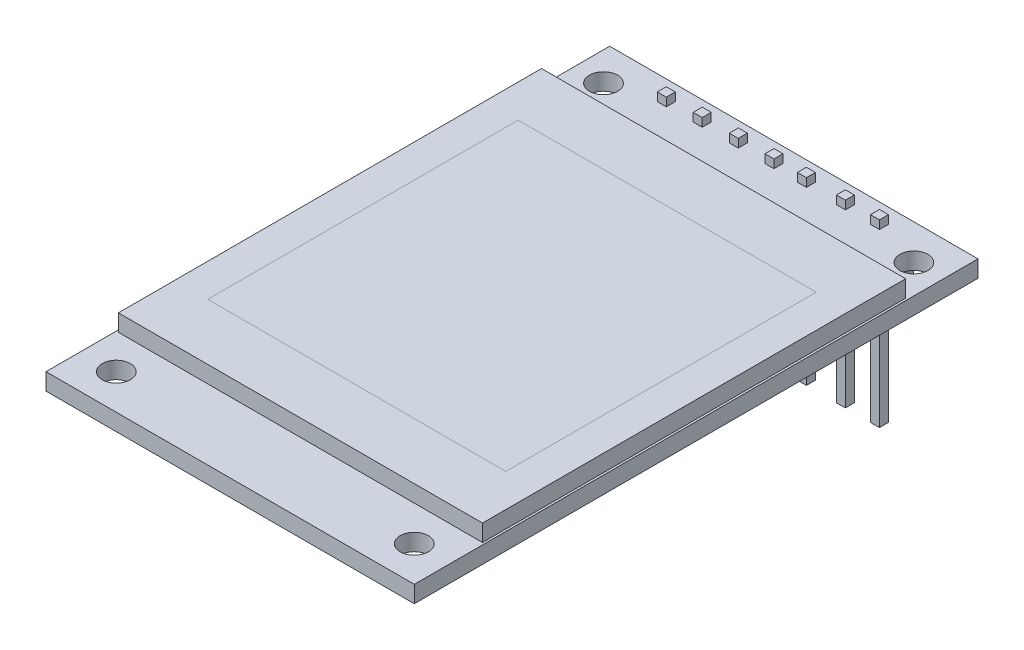
from build123d import *

# Parameters (mm, degrees)
PCB_2_W                   = 26.2
PCB_2_H                   = 40.1
PCB_2_R                   = 1
PCB_DEPTH                 = 1.2
OLED_2_W                  = 25.9
OLED_2_H                  = 30.1
OLED_2_W_2                = 21.2
OLED_2_H_2                = 22.08
OLED_DEPTH                = 1.2
OLED_2_2_W                = 21.2
OLED_2_2_H                = 22.08
OLED_3_DEPTH              = 1.2
SKETCH_2_54_W             = 17.78
SKETCH_2_54_H             = 2.54
SKETCH_2_54_W_2           = 0.64
SKETCH_2_54_H_2           = 0.64
EXTRUDE_2_54_0_DEPTH      = 2.5
EXTRUDE_2_54_1_DEPTH      = 11
EXTRUDE_2_54_1_DEPTH_BACK = 1.8
SKETCH_2_54_3_W           = 0.64
SKETCH_2_54_3_H           = 0.64


with BuildPart() as part:
    # PCB 2 → PCB (new body)
    with BuildSketch(Plane(origin=(0, 0, 0), x_dir=(1, 0, 0), z_dir=(0, 1, 0))):
        Rectangle(PCB_2_W, PCB_2_H)
        with Locations((-10.6, -17.55)):
            Circle(PCB_2_R, mode=Mode.SUBTRACT)
        with Locations((10.6, -17.55)):
            Circle(PCB_2_R, mode=Mode.SUBTRACT)
        with Locations((-11.04, 17.55)):
            Circle(PCB_2_R, mode=Mode.SUBTRACT)
        with Locations((11.04, 17.55)):
            Circle(PCB_2_R, mode=Mode.SUBTRACT)
    extrude(amount=PCB_DEPTH)

    # 2.54端子草图 → 2.54端子0 (add)
    with BuildSketch(Plane.XZ):
        with Locations((-0.15, -18.55)):
            Rectangle(SKETCH_2_54_W, SKETCH_2_54_H)
        with Locations((7.47, -18.667667874)):
            Rectangle(SKETCH_2_54_W_2, SKETCH_2_54_H_2, mode=Mode.SUBTRACT)
        with Locations((5.047667874, -18.667667874)):
            Rectangle(SKETCH_2_54_W_2, SKETCH_2_54_H_2, mode=Mode.SUBTRACT)
        with Locations((2.272332126, -18.667667874)):
            Rectangle(SKETCH_2_54_W_2, SKETCH_2_54_H_2, mode=Mode.SUBTRACT)
        with Locations((-0.032332126, -18.667667874)):
            Rectangle(SKETCH_2_54_W_2, SKETCH_2_54_H_2, mode=Mode.SUBTRACT)
        with Locations((-2.572332126, -18.667667874)):
            Rectangle(SKETCH_2_54_W_2, SKETCH_2_54_H_2, mode=Mode.SUBTRACT)
        with Locations((-5.136389737, -18.667667874)):
            Rectangle(SKETCH_2_54_W_2, SKETCH_2_54_H_2, mode=Mode.SUBTRACT)
        with Locations((-7.672296396, -18.647703604)):
            Rectangle(SKETCH_2_54_W_2, SKETCH_2_54_H_2, mode=Mode.SUBTRACT)
    extrude(amount=EXTRUDE_2_54_0_DEPTH)

    # 2.54端子草图<3> → 2.54端子1 (add, two sides: drawn at the far end of the back side and taken through both)
    with BuildSketch(Plane.XZ.offset(-EXTRUDE_2_54_1_DEPTH_BACK)):
        with Locations((7.47, -18.667667874)):
            Rectangle(SKETCH_2_54_3_W, SKETCH_2_54_3_H)
        with Locations((5.047667874, -18.667667874)):
            Rectangle(SKETCH_2_54_3_W, SKETCH_2_54_3_H)
        with Locations((2.272332126, -18.667667874)):
            Rectangle(SKETCH_2_54_3_W, SKETCH_2_54_3_H)
        with Locations((-0.032332126, -18.667667874)):
            Rectangle(SKETCH_2_54_3_W, SKETCH_2_54_3_H)
        with Locations((-2.572332126, -18.667667874)):
            Rectangle(SKETCH_2_54_3_W, SKETCH_2_54_3_H)
        with Locations((-5.136389737, -18.667667874)):
            Rectangle(SKETCH_2_54_3_W, SKETCH_2_54_3_H)
        with Locations((-7.672296396, -18.647703604)):
            Rectangle(SKETCH_2_54_3_W, SKETCH_2_54_3_H)
    extrude(amount=EXTRUDE_2_54_1_DEPTH + EXTRUDE_2_54_1_DEPTH_BACK)


with BuildPart() as body_2:
    # OLED 2 → OLED (new body)
    with BuildSketch(Plane(origin=(0, 1.2, 0), x_dir=(1, 0, 0), z_dir=(0, 1, 0))):
        Rectangle(OLED_2_W, OLED_2_H)
        Rectangle(OLED_2_W_2, OLED_2_H_2, mode=Mode.SUBTRACT)
    extrude(amount=OLED_DEPTH)


with BuildPart() as body_3:
    # OLED_2 2 → OLED 3 (new body)
    with BuildSketch(Plane(origin=(0, 1.2, 0), x_dir=(1, 0, 0), z_dir=(0, 1, 0))):
        Rectangle(OLED_2_2_W, OLED_2_2_H)
    extrude(amount=OLED_3_DEPTH)


solid = Compound([part.part, body_2.part, body_3.part])
